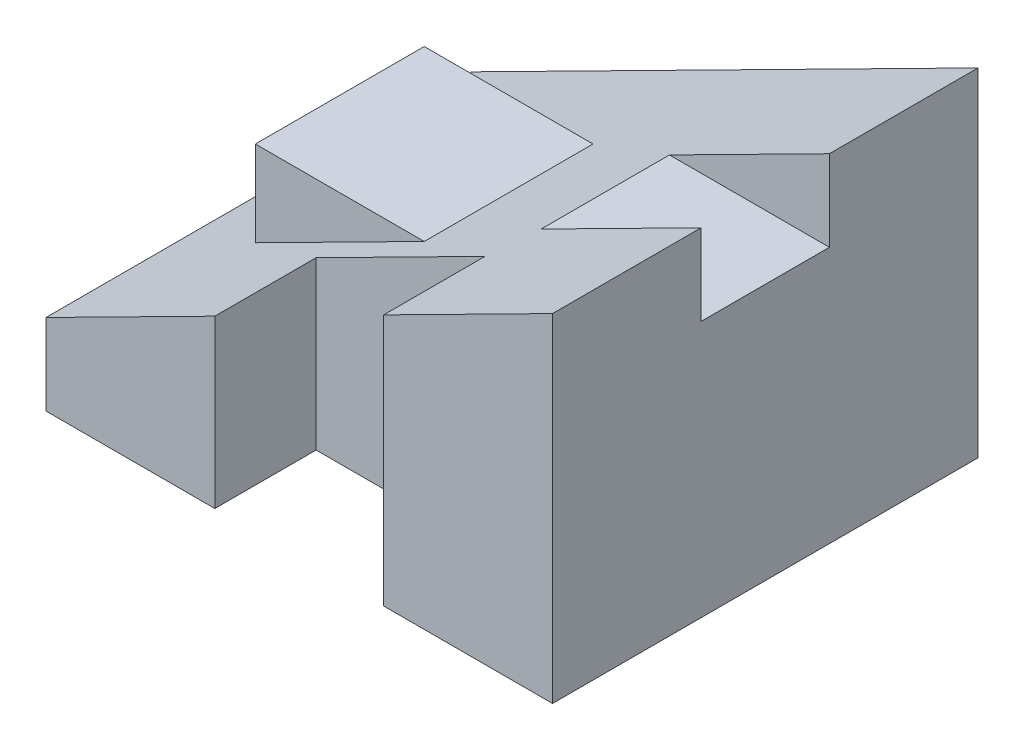
from build123d import *

# Parameters (mm, degrees)
SKETCH1_W           = 25
SKETCH1_H           = 25
BOSS_EXTRUDE1_DEPTH = 50
CUT_EXTRUDE2_REACH  = 111.973
CUT_EXTRUDE3_REACH  = 111.973
SKETCH3_W           = 19
SKETCH3_H           = 12
SKETCH1_3_W         = 25
SKETCH1_3_H         = 25
BOSS_EXTRUDE2_DEPTH = 31
CUT_EXTRUDE4_REACH  = 102.305
SKETCH4_W           = 25
SKETCH4_H           = 0.253333333


with BuildPart() as part:
    # Sketch1 → Boss-Extrude1 (new body)
    with BuildSketch(Plane(origin=(0, 0, 0), x_dir=(1, 0, 0), z_dir=(0, 1, 0))):
        Polygon((0, 0), (25, 0), (25, 15), (50, 15), (50, 0), (75, 0), (75, 63), (0, 63), align=None)
        with Locations((24.5, 31.5)):
            Rectangle(SKETCH1_W, SKETCH1_H, mode=Mode.SUBTRACT)
    extrude(amount=BOSS_EXTRUDE1_DEPTH)

    # Sketch2 → Cut-Extrude2 (cut, up to next)
    with BuildSketch(Plane(origin=(0, 0, -63), x_dir=(-1, 0, 0), z_dir=(0, 0, -1)), mode=Mode.PRIVATE) as cut_extrude2_sk1:
        Polygon((0, 12), (-75, 50), (0, 50), align=None)
    cut_extrude2_tool1 = extrude(cut_extrude2_sk1.sketch, amount=-CUT_EXTRUDE2_REACH, mode=Mode.PRIVATE) & part.part
    add(cut_extrude2_tool1.solids().sort_by_distance((25, 37.333333, -63))[0], mode=Mode.SUBTRACT)

    # Sketch3 → Cut-Extrude3 (cut, up to next)
    with BuildSketch(Plane(origin=(75, 0, 0), x_dir=(0, 0, -1), z_dir=(1, 0, 0)), mode=Mode.PRIVATE) as cut_extrude3_sk1:
        with Locations((31.5, 44)):
            Rectangle(SKETCH3_W, SKETCH3_H)
    cut_extrude3_tool1 = extrude(cut_extrude3_sk1.sketch, amount=-CUT_EXTRUDE3_REACH, mode=Mode.PRIVATE) & part.part
    add(cut_extrude3_tool1.solids().sort_by_distance((75, 44, -31.5))[0], mode=Mode.SUBTRACT)

    # Sketch1<3> → Boss-Extrude2 (add)
    with BuildSketch(Plane(origin=(0, 0, 0), x_dir=(1, 0, 0), z_dir=(0, 1, 0))):
        with Locations((24.5, 31.5)):
            Rectangle(SKETCH1_3_W, SKETCH1_3_H)
    extrude(amount=BOSS_EXTRUDE2_DEPTH)

    # Sketch4 → Cut-Extrude4 (cut, up to next)
    with BuildSketch(Plane.XY.offset(-19), mode=Mode.PRIVATE) as cut_extrude4_sk1:
        with Locations((24.5, 30.873333334)):
            Rectangle(SKETCH4_W, SKETCH4_H)
    cut_extrude4_tool1 = extrude(cut_extrude4_sk1.sketch, amount=-CUT_EXTRUDE4_REACH, mode=Mode.PRIVATE) & part.part
    add(cut_extrude4_tool1.solids().sort_by_distance((24.5, 30.873333, -19))[0], mode=Mode.SUBTRACT)


solid = part.part
